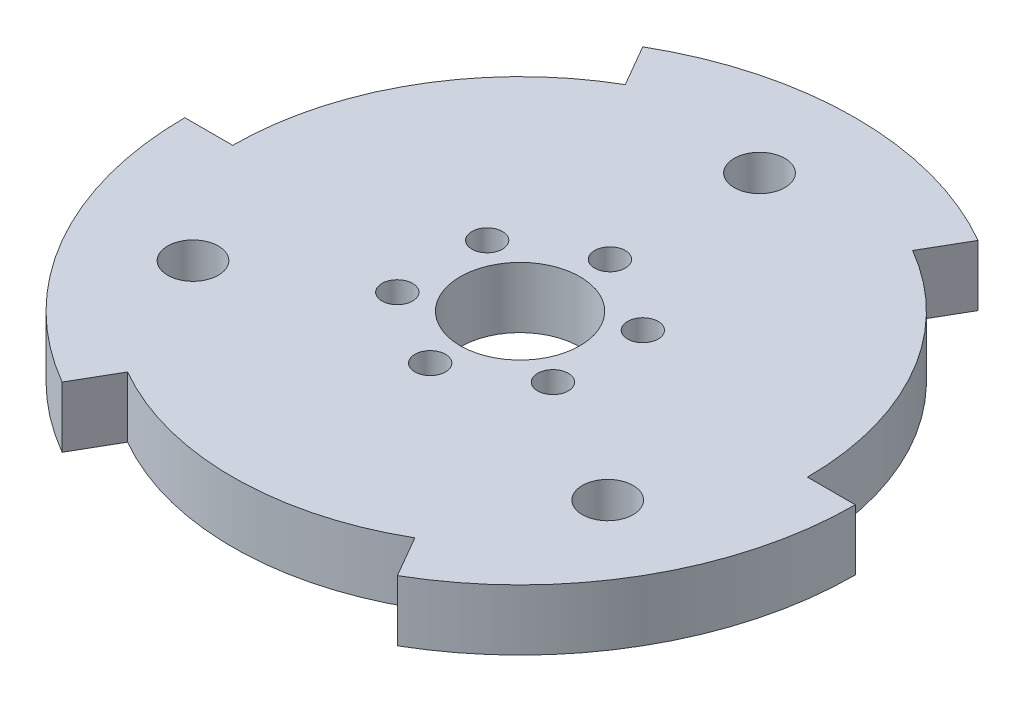
from build123d import *

# Parameters (mm, degrees)
BASEPLATE_SKETCH_R   = 2.65
BASEPLATE_SKETCH_R_2 = 6.25
BOSS_EXTRUDE1_DEPTH  = 6.35
SKETCH3_R            = 1.6
CUT_EXTRUDE2_DEPTH   = 6.35


with BuildPart() as part:
    # Baseplate Sketch → Boss-Extrude1 (new body)
    with BuildSketch(Plane(origin=(0, 0, 0), x_dir=(1, 0, 0), z_dir=(0, 1, 0))):
        with BuildLine():
            ThreePointArc((17.5, 30.310889132), (0, 35), (-17.5, 30.310889132))
            Line((-17.5, 30.310889132), (-15, 25.980762114))
            ThreePointArc((-15, 25.980762114), (-25.980762114, 15), (-30, 0))
            Line((-30, 0), (-35, 0))
            ThreePointArc((-35, 0), (-30.310889132, -17.5), (-17.5, -30.310889132))
            Line((-17.5, -30.310889132), (-15, -25.980762114))
            ThreePointArc((-15, -25.980762114), (0, -30), (15, -25.980762114))
            Line((15, -25.980762114), (17.5, -30.310889132))
            ThreePointArc((17.5, -30.310889132), (30.310889132, -17.5), (35, 0))
            Line((35, 0), (30, 0))
            ThreePointArc((30, 0), (25.980762114, 15), (15, 25.980762114))
            Line((15, 25.980762114), (17.5, 30.310889132))
        make_face()
        with Locations(Location((0, 25, 0), (0, 0, 270))):
            Circle(BASEPLATE_SKETCH_R, mode=Mode.SUBTRACT)
        with Locations(Location((-21.650635095, -12.5, 0), (0, 0, 270))):
            Circle(BASEPLATE_SKETCH_R, mode=Mode.SUBTRACT)
        with Locations(Location((0, 0, 0), (0, 0, 270))):
            Circle(BASEPLATE_SKETCH_R_2, mode=Mode.SUBTRACT)
        with Locations(Location((21.650635095, -12.5, 0), (0, 0, 270))):
            Circle(BASEPLATE_SKETCH_R, mode=Mode.SUBTRACT)
    extrude(amount=BOSS_EXTRUDE1_DEPTH)

    # Sketch3 → Cut-Extrude2 (cut)
    with BuildSketch(Plane(origin=(0, 6.35, 0), x_dir=(1, 0, 0), z_dir=(0, 1, 0))):
        with Locations(Location((-8.127648415, -4.6925, 0), (0, 0, 270))):
            Circle(SKETCH3_R)
        with Locations(Location((0, -9.385, 0), (0, 0, 270))):
            Circle(SKETCH3_R)
        with Locations(Location((-8.127648415, 4.6925, 0), (0, 0, 270))):
            Circle(SKETCH3_R)
        with Locations(Location((0, 9.385, 0), (0, 0, 270))):
            Circle(SKETCH3_R)
        with Locations(Location((8.127648415, 4.6925, 0), (0, 0, 270))):
            Circle(SKETCH3_R)
        with Locations(Location((8.127648415, -4.6925, 0), (0, 0, 270))):
            Circle(SKETCH3_R)
    extrude(amount=-CUT_EXTRUDE2_DEPTH, mode=Mode.SUBTRACT)


solid = part.part
